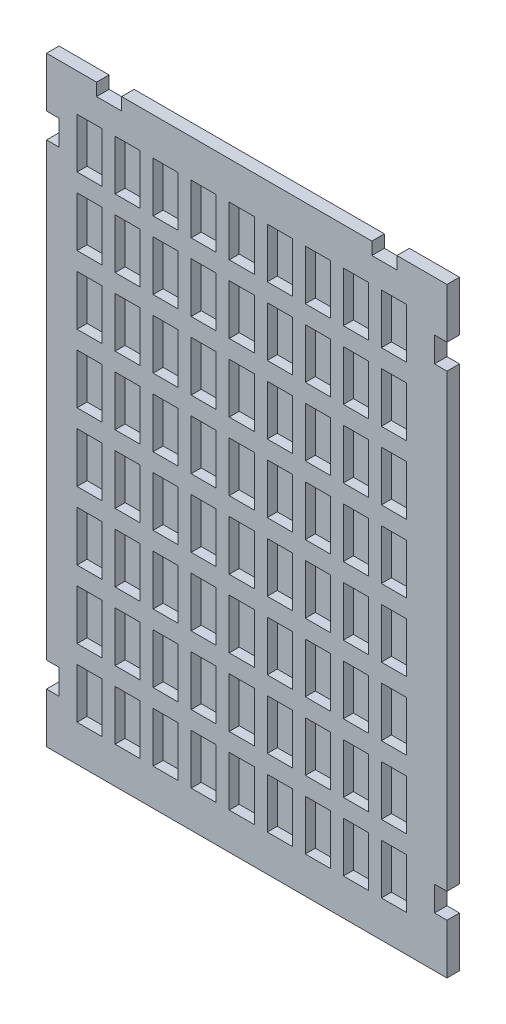
from build123d import *

# Parameters (mm, degrees)
BOSS_EXTRUDE1_DEPTH  = 3.175
SKETCH2_W            = 6.35
SKETCH2_H            = 12.7
CUT_EXTRUDE1_DEPTH   = 2.54
LPATTERN1_COUNT      = 9
LPATTERN1_PITCH      = 9.652
LPATTERN1_COUNT_DIR2 = 8
LPATTERN1_PITCH_DIR2 = 17.272


with BuildPart() as part:
    # Sketch1 → Boss-Extrude1 (new body)
    with BuildSketch(Plane.XY):
        Polygon((0, -152.4), (12.7, -152.4), (88.9, -152.4), (101.6, -152.4), (101.6, -139.7), (98.425, -139.7), (98.425, -133.35), (101.6, -133.35), (101.6, -19.05), (98.425, -19.05), (98.425, -12.7), (101.6, -12.7), (101.6, 0), (88.9, 0), (88.9, -3.175), (82.55, -3.175), (82.55, 0), (19.05, 0), (19.05, -3.175), (12.7, -3.175), (12.7, 0), (0, 0), (0, -12.7), (3.175, -12.7), (3.175, -19.05), (0, -19.05), (0, -133.35), (3.175, -133.35), (3.175, -139.7), (0, -139.7), align=None)
    extrude(amount=BOSS_EXTRUDE1_DEPTH)

    # Sketch2 → Cut-Extrude1 (cut)
    with BuildSketch(Plane.XY.offset(3.175)):
        with Locations((10.922, -15.875)):
            Rectangle(SKETCH2_W, SKETCH2_H)
    cut_extrude1 = extrude(amount=-CUT_EXTRUDE1_DEPTH, mode=Mode.SUBTRACT)

    # LPattern1: Cut-Extrude1 9 × 8
    with Locations(*[(i * LPATTERN1_PITCH, -j * LPATTERN1_PITCH_DIR2, 0) for i in range(LPATTERN1_COUNT) for j in range(LPATTERN1_COUNT_DIR2) if (i, j) != (0, 0)]):
        add(cut_extrude1, mode=Mode.SUBTRACT)


solid = part.part
